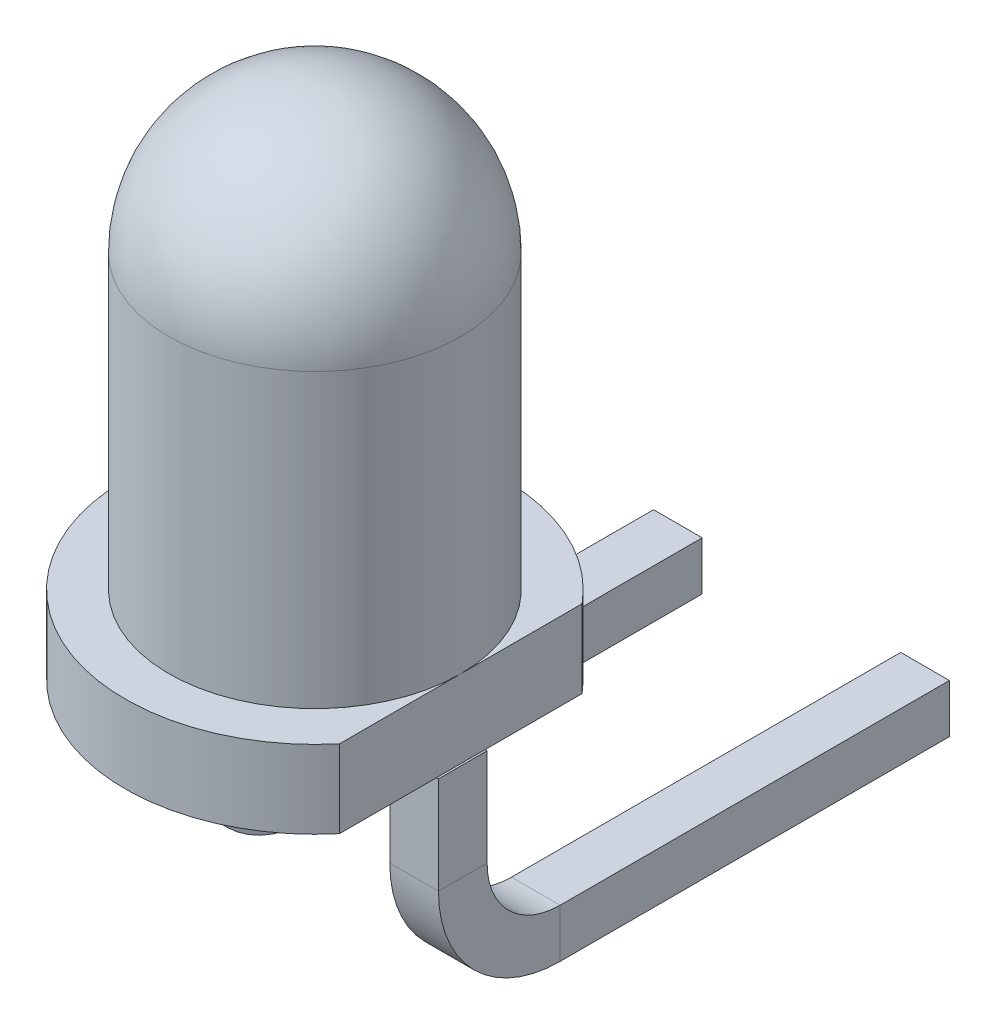
from build123d import *

# Parameters (mm, degrees)
SKETCH2_W          = 0.45
SKETCH2_H          = 2.491987158
CUT_EXTRUDE1_DEPTH = 6.97452927
SKETCH3_W          = 0.5
SKETCH3_H          = 0.5


with BuildPart() as part:
    # Sketch1 → Revolve1 (revolve)
    with BuildSketch(Plane(origin=(0, 0, 0), x_dir=(1, 0, 0), z_dir=(0, 0, -1))):
        with BuildLine():
            Line((0, 0), (0, -5.3))
            ThreePointArc((0, -5.3), (1.060660172, -4.860660172), (1.5, -3.8))
            Line((1.5, -3.8), (1.5, -0.8))
            Line((1.5, -0.8), (1.95, -0.8))
            Line((1.95, -0.8), (1.95, 0))
            Line((1.95, 0), (0, 0))
        make_face()
    revolve(axis=Axis((0, 0, 0), (0, 1, 0)))

    # Sketch2 → Cut-Extrude1 (cut, through all)
    with BuildSketch(Plane(origin=(0, 0, 0), x_dir=(-1, 0, 0), z_dir=(0, -1, 0))):
        with Locations((-1.725, 0)):
            Rectangle(SKETCH2_W, SKETCH2_H)
    extrude(amount=-CUT_EXTRUDE1_DEPTH, mode=Mode.SUBTRACT)

    # Sweep1: sweep along a path in Sketch4
    with BuildLine(Plane(origin=(-1.27, 0, 0), x_dir=(0, 0, -1), z_dir=(1, 0, 0))) as sweep1_path:
        Line((0, 0), (0, -1))
        ThreePointArc((0, -1), (0.292893219, -1.707106781), (1, -2))
        Line((1, -2), (5, -2))
    # Sketch3 → Sweep1 (sweep)
    with BuildSketch(Plane(origin=(0, 0, 0), x_dir=(-1, 0, 0), z_dir=(0, -1, 0))):
        with Locations((-1.27, 0)):
            Rectangle(SKETCH3_W, SKETCH3_H)
        with Locations((1.27, 0)):
            Rectangle(SKETCH3_W, SKETCH3_H)
    sweep(path=sweep1_path.line)


solid = part.part
